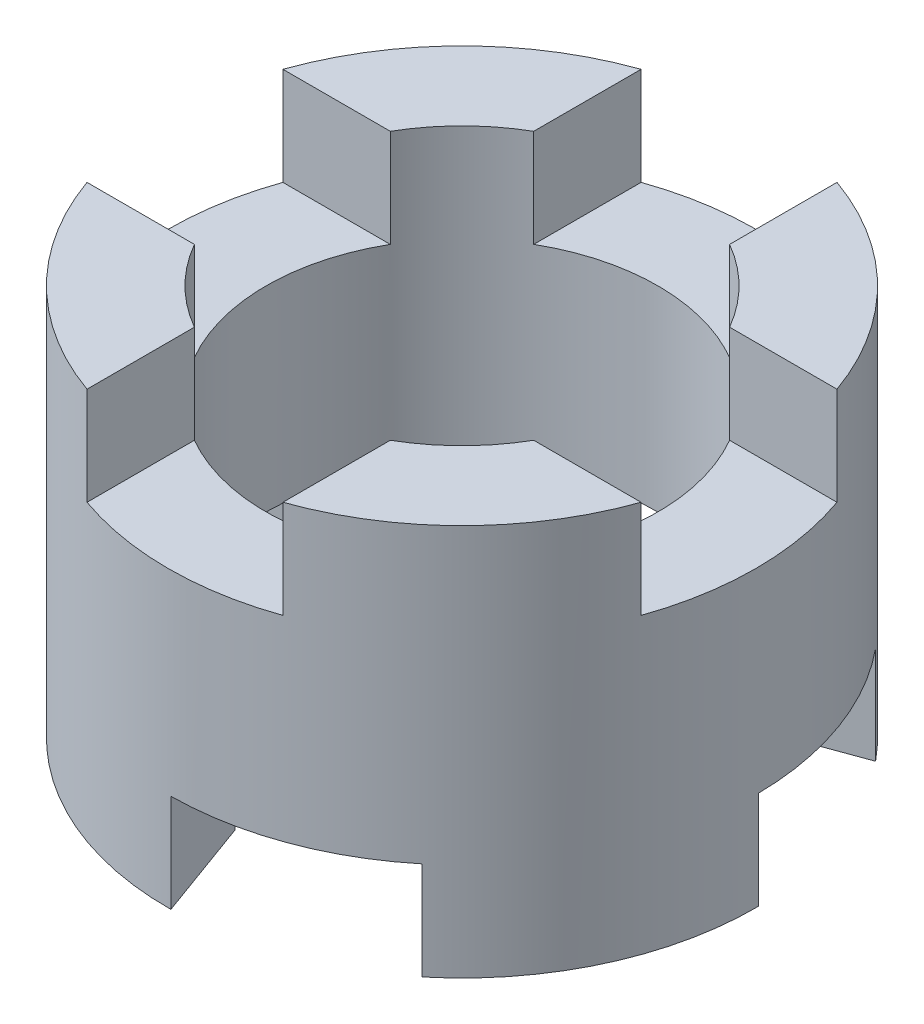
from build123d import *

# Parameters (mm, degrees)
SKETCH2_R           = 19.05
SKETCH2_R_2         = 12.7
BOSS_EXTRUDE2_DEPTH = 25.4
SKETCH4_W           = 76.2
SKETCH4_H           = 12.7
CUT_EXTRUDE7_DEPTH  = 6.35
CIRPATTERN1_COUNT   = 2
CIRPATTERN1_ANGLE   = 90
CUT_EXTRUDE9_DEPTH  = 6.35
CIRPATTERN2_COUNT   = 2
CIRPATTERN2_ANGLE   = 90


with BuildPart() as part:
    # Sketch2 → Boss-Extrude2 (new body)
    with BuildSketch(Plane(origin=(0, 0, 0), x_dir=(1, 0, 0), z_dir=(0, 1, 0))):
        with Locations(Location((0, 0, 0), (0, 0, 270))):
            Circle(SKETCH2_R)
        with Locations(Location((0, 0, 0), (0, 0, 270))):
            Circle(SKETCH2_R_2, mode=Mode.SUBTRACT)
    extrude(amount=BOSS_EXTRUDE2_DEPTH)

    # Sketch4 → Cut-Extrude7 (cut)
    with BuildSketch(Plane(origin=(0, 25.4, 0), x_dir=(1, 0, 0), z_dir=(0, 1, 0))):
        Rectangle(SKETCH4_W, SKETCH4_H)
    cut_extrude7 = extrude(amount=-CUT_EXTRUDE7_DEPTH, mode=Mode.SUBTRACT)

    # CirPattern1: Cut-Extrude7 ×2 about axis
    cirpattern1_axis = Axis((0, 25.4, 0), (0, 1, 0))
    for i in range(1, CIRPATTERN1_COUNT):
        add(cut_extrude7.rotate(cirpattern1_axis, i * CIRPATTERN1_ANGLE / (CIRPATTERN1_COUNT - 1)), mode=Mode.SUBTRACT)

    # Sketch8 → Cut-Extrude9 (cut)
    with BuildSketch(Plane.XZ):
        Polygon((-27.795701489, 16.874336838), (32.139357309, -4.940240554), (27.795701489, -16.874336838), (-32.139357309, 4.940240554), align=None)
    cut_extrude9 = extrude(amount=-CUT_EXTRUDE9_DEPTH, mode=Mode.SUBTRACT)

    # CirPattern2: Cut-Extrude9 ×2 about axis
    cirpattern2_axis = Axis((0, 0, 0), (0, 1, 0))
    for i in range(1, CIRPATTERN2_COUNT):
        add(cut_extrude9.rotate(cirpattern2_axis, i * CIRPATTERN2_ANGLE / (CIRPATTERN2_COUNT - 1)), mode=Mode.SUBTRACT)


solid = part.part
